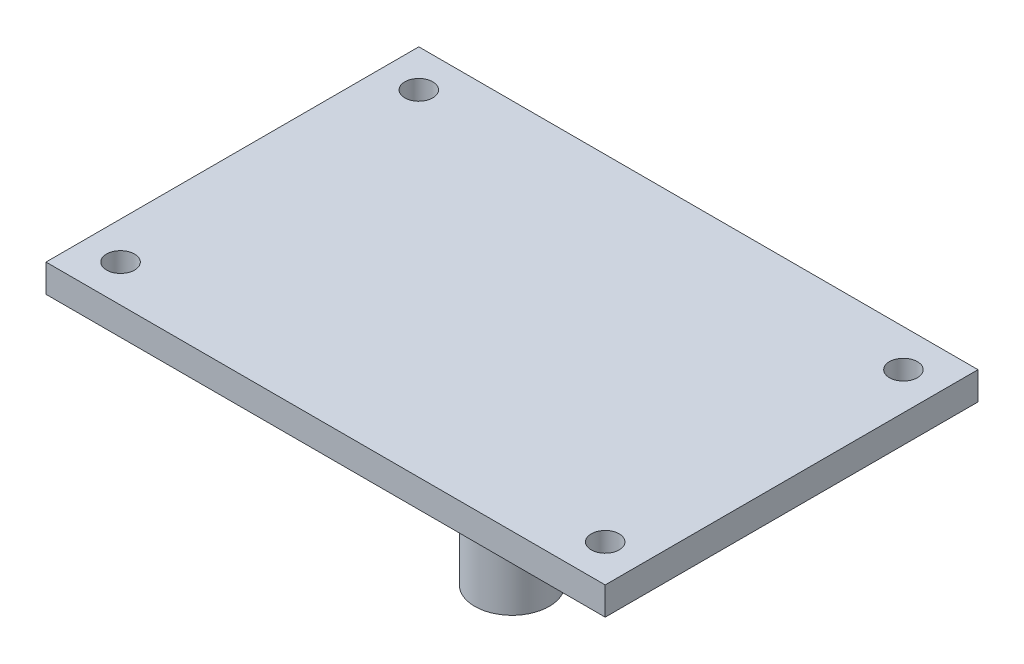
from build123d import *

# Parameters (mm, degrees)
SKETCH1_R           = 4
BOSS_EXTRUDE1_DEPTH = 18
SKETCH2_R           = 5
BOSS_EXTRUDE2_DEPTH = 4
SKETCH3_W           = 60
SKETCH3_H           = 40
SKETCH3_R           = 1.5
BOSS_EXTRUDE3_DEPTH = 3


with BuildPart() as part:
    # Sketch1 → Boss-Extrude1 (new body)
    with BuildSketch(Plane(origin=(0, 0, 0), x_dir=(1, 0, 0), z_dir=(0, 1, 0))):
        with Locations(Location((0, 0, 0), (0, 0, 270))):
            Circle(SKETCH1_R)
    extrude(amount=BOSS_EXTRUDE1_DEPTH)

    # Sketch2 → Boss-Extrude2 (add)
    with BuildSketch(Plane(origin=(0, 18, 0), x_dir=(1, 0, 0), z_dir=(0, 1, 0))):
        with Locations(Location((0, 0, 0), (0, 0, 270))):
            Circle(SKETCH2_R)
    extrude(amount=BOSS_EXTRUDE2_DEPTH)

    # Sketch3 → Boss-Extrude3 (add)
    with BuildSketch(Plane(origin=(0, 22, 0), x_dir=(1, 0, 0), z_dir=(0, 1, 0))):
        Rectangle(SKETCH3_W, SKETCH3_H)
        with Locations(Location((-26, 16, 0), (0, 0, 270))):
            Circle(SKETCH3_R, mode=Mode.SUBTRACT)
        with Locations(Location((26, 16, 0), (0, 0, 90))):
            Circle(SKETCH3_R, mode=Mode.SUBTRACT)
        with Locations(Location((26, -16, 0), (0, 0, 270))):
            Circle(SKETCH3_R, mode=Mode.SUBTRACT)
        with Locations(Location((-26, -16, 0), (0, 0, 90))):
            Circle(SKETCH3_R, mode=Mode.SUBTRACT)
    extrude(amount=BOSS_EXTRUDE3_DEPTH)


solid = part.part
